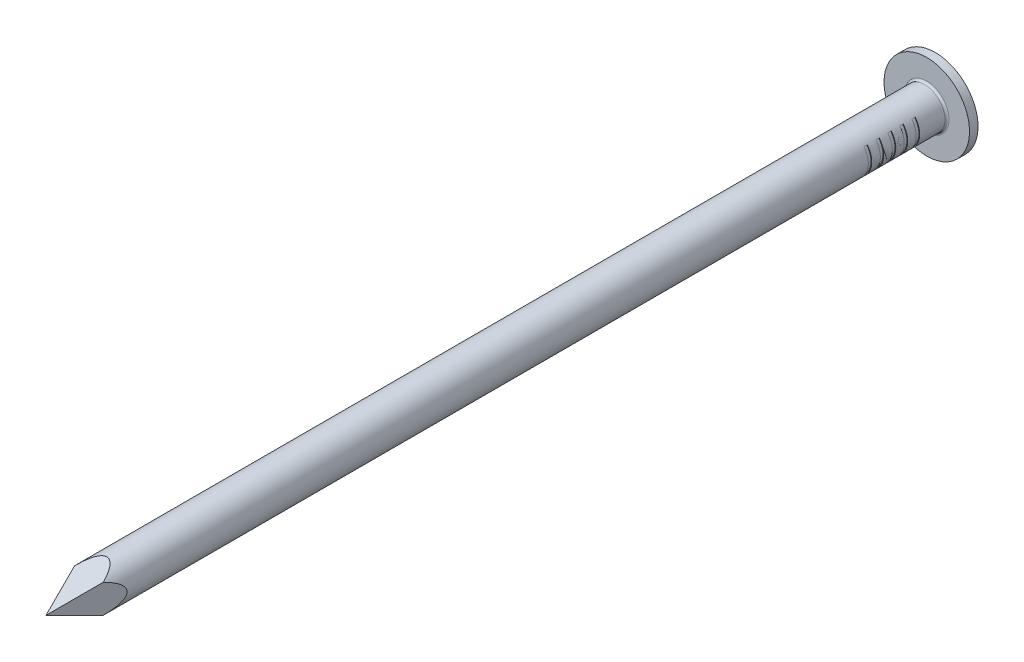
from build123d import *

# Parameters (mm, degrees)
CUT_EXTRUDE1_DEPTH      = 42.360505525
CIRPATTERN1_COUNT       = 4
SKETCH5_W               = 0.79375
SKETCH5_H               = 3.96875
FILLET1_R               = 0.18796
CUT_EXTRUDE3_REACH      = 43.876
CUT_EXTRUDE3_END_RADIUS = 1.8161
SKETCH6_W               = 0.3175
SKETCH6_H               = 2.3495


with BuildPart() as part:
    # Sketch2 → Revolve1 (revolve)
    with BuildSketch(Plane(origin=(0, 0, 0), x_dir=(0, 0, -1), z_dir=(1, 0, 0))):
        Polygon((-35.6362, -1.8796), (41.275, -1.8796), (41.275, 0), (-41.275, 0), (-41.275, -1.8796), align=None)
    revolve(axis=Axis((0, 0, 41.275), (0, 0, -1)))

    # Sketch3 → Cut-Extrude1 (cut, symmetric)
    with BuildSketch(Plane(origin=(0, 0, 0), x_dir=(0, 0, -1), z_dir=(1, 0, 0))):
        Polygon((-41.275, -0.00254), (-35.6362, -1.8796), (-41.275, -1.8796), align=None)
    cut_extrude1 = extrude(amount=CUT_EXTRUDE1_DEPTH, both=True, mode=Mode.SUBTRACT)

    # CirPattern1: Cut-Extrude1 ×4 about axis
    cirpattern1_axis = Axis((0, 0, 0), (0, 0, 1))
    for i in range(1, CIRPATTERN1_COUNT):
        add(cut_extrude1.rotate(cirpattern1_axis, i * 360 / CIRPATTERN1_COUNT), mode=Mode.SUBTRACT)

    # Sketch5 → Revolve2 (revolve)
    with BuildSketch(Plane(origin=(0, 0, 0), x_dir=(0, 0, -1), z_dir=(1, 0, 0)), mode=Mode.PRIVATE) as revolve2_sk:
        with Locations((40.878125, 1.984375)):
            Rectangle(SKETCH5_W, SKETCH5_H)
    revolve(revolve2_sk.sketch.rotate(Axis((0, 0, -41.275), (0, 0, 1)), 135), axis=Axis((0, 0, -41.275), (0, 0, 1)))

    # Fillet1
    fillet1_edges = [part.edges().sort_by_distance(p)[0] for p in [
        (0, 1.8796, -40.48125),
    ]]
    fillet(fillet1_edges, radius=FILLET1_R)

    # Cut-Extrude3: up to this cylinder (the profile starts outside it)
    cut_extrude3_end = Plane(origin=(0, 0, -35.56), z_dir=(0, 0, 1)) * Cylinder(CUT_EXTRUDE3_END_RADIUS, 96.8292, mode=Mode.PRIVATE)
    # Sketch6 → Cut-Extrude3 (cut, up to the surface)
    with BuildSketch(Plane(origin=(1.8796, 0, 0), x_dir=(0, 0, -1), z_dir=(1, 0, 0)), mode=Mode.PRIVATE) as cut_extrude3_sk1:
        with Locations((33.3375, 0)):
            Rectangle(SKETCH6_W, SKETCH6_H)
    cut_extrude3_tool1 = extrude(cut_extrude3_sk1.sketch, amount=-CUT_EXTRUDE3_REACH, mode=Mode.PRIVATE) - cut_extrude3_end
    # Sketch6 → Cut-Extrude3 (cut, up to the surface)
    with BuildSketch(Plane(origin=(1.8796, 0, 0), x_dir=(0, 0, -1), z_dir=(1, 0, 0)), mode=Mode.PRIVATE) as cut_extrude3_sk2:
        with Locations((34.44875, 0)):
            Rectangle(SKETCH6_W, SKETCH6_H)
    cut_extrude3_tool2 = extrude(cut_extrude3_sk2.sketch, amount=-CUT_EXTRUDE3_REACH, mode=Mode.PRIVATE) - cut_extrude3_end
    # Sketch6 → Cut-Extrude3 (cut, up to the surface)
    with BuildSketch(Plane(origin=(1.8796, 0, 0), x_dir=(0, 0, -1), z_dir=(1, 0, 0)), mode=Mode.PRIVATE) as cut_extrude3_sk3:
        with Locations((35.56, 0)):
            Rectangle(SKETCH6_W, SKETCH6_H)
    cut_extrude3_tool3 = extrude(cut_extrude3_sk3.sketch, amount=-CUT_EXTRUDE3_REACH, mode=Mode.PRIVATE) - cut_extrude3_end
    # Sketch6 → Cut-Extrude3 (cut, up to the surface)
    with BuildSketch(Plane(origin=(1.8796, 0, 0), x_dir=(0, 0, -1), z_dir=(1, 0, 0)), mode=Mode.PRIVATE) as cut_extrude3_sk4:
        with Locations((36.67125, 0)):
            Rectangle(SKETCH6_W, SKETCH6_H)
    cut_extrude3_tool4 = extrude(cut_extrude3_sk4.sketch, amount=-CUT_EXTRUDE3_REACH, mode=Mode.PRIVATE) - cut_extrude3_end
    # Sketch6 → Cut-Extrude3 (cut, up to the surface)
    with BuildSketch(Plane(origin=(1.8796, 0, 0), x_dir=(0, 0, -1), z_dir=(1, 0, 0)), mode=Mode.PRIVATE) as cut_extrude3_sk5:
        with Locations((37.7825, 0)):
            Rectangle(SKETCH6_W, SKETCH6_H)
    cut_extrude3_tool5 = extrude(cut_extrude3_sk5.sketch, amount=-CUT_EXTRUDE3_REACH, mode=Mode.PRIVATE) - cut_extrude3_end
    cut_extrude3 = cut_extrude3_tool1.solids().sort_by_distance((1.8796, 0, -33.3375))[0] + cut_extrude3_tool2.solids().sort_by_distance((1.8796, 0, -34.44875))[0] + cut_extrude3_tool3.solids().sort_by_distance((1.8796, 0, -35.56))[0] + cut_extrude3_tool4.solids().sort_by_distance((1.8796, 0, -36.67125))[0] + cut_extrude3_tool5.solids().sort_by_distance((1.8796, 0, -37.7825))[0]
    add(cut_extrude3, mode=Mode.SUBTRACT)

    # Mirror1: Cut-Extrude3 across plane
    add(cut_extrude3.mirror(Plane(origin=(0, 0, 0), x_dir=(0, 0, 1), z_dir=(1, 0, 0))), mode=Mode.SUBTRACT)


solid = part.part
